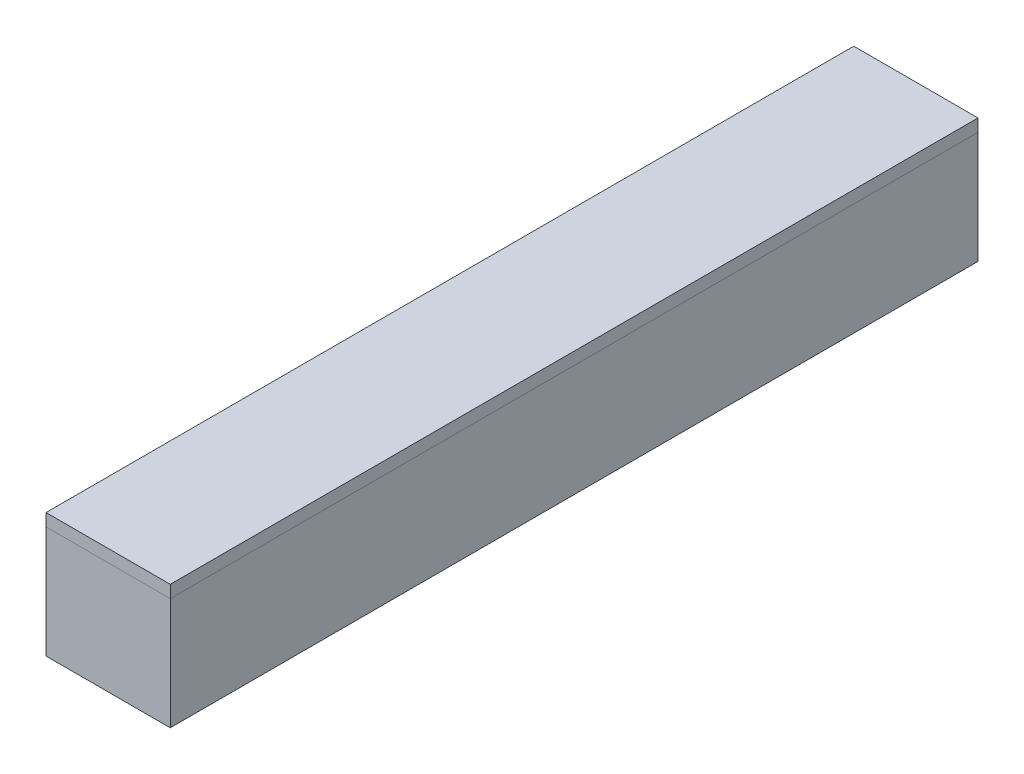
from build123d import *

# Parameters (mm, degrees)
SKETCH1_W           = 10
SKETCH1_H           = 65
BOSS_EXTRUDE1_DEPTH = 0.64
SKETCH1_2_W         = 10
SKETCH1_2_H         = 65
BOSS_EXTRUDE2_DEPTH = 10


with BuildPart() as part:
    # Sketch1 → Boss-Extrude1 (new body)
    with BuildSketch(Plane(origin=(0, 0, 0), x_dir=(1, 0, 0), z_dir=(0, 1, 0))):
        with Locations((-5, -32.5)):
            Rectangle(SKETCH1_W, SKETCH1_H)
    extrude(amount=-BOSS_EXTRUDE1_DEPTH)

    # Sketch1<2> → Boss-Extrude2 (add)
    with BuildSketch(Plane(origin=(0, 0, 0), x_dir=(1, 0, 0), z_dir=(0, 1, 0))):
        with Locations((-5, -32.5)):
            Rectangle(SKETCH1_2_W, SKETCH1_2_H)
        Polygon((-8.224368927, -27.993471794), (-7.79702915, -21.006528206), (-0.79702915, -21.006528206), (-1.224368927, -27.993471794), align=None, mode=Mode.SUBTRACT)
        Polygon((-8.775631073, -37.006528206), (-1.775631073, -37.006528206), (-2.20297085, -43.993471794), (-9.20297085, -43.993471794), align=None, mode=Mode.SUBTRACT)
    extrude(amount=-BOSS_EXTRUDE2_DEPTH)


with BuildPart() as body_2:
    # Split1: the piece on the far side of the plane
    add(part.part)
    split(bisect_by=Plane.ZX.offset(-1), keep=Keep.BOTTOM)


with BuildPart() as part_1:
    add(part.part)

    # Split1
    split(bisect_by=Plane.ZX.offset(-1), keep=Keep.TOP)


solid = Compound([body_2.part, part_1.part])
